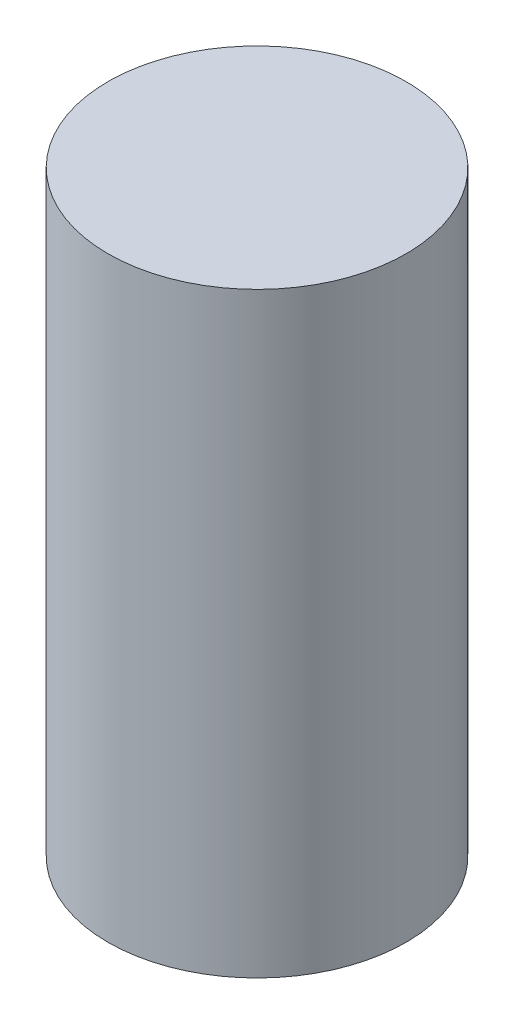
from build123d import *

# Parameters (mm, degrees)
CROQUIS1_R              = 25
SALIENTE_EXTRUIR1_DEPTH = 100


with BuildPart() as part:
    # Croquis1 → Saliente-Extruir1 (new body)
    with BuildSketch(Plane(origin=(0, 0, 0), x_dir=(1, 0, 0), z_dir=(0, 1, 0))):
        with Locations(Location((0, 0, 0), (0, 0, 270))):
            Circle(CROQUIS1_R)
    extrude(amount=SALIENTE_EXTRUIR1_DEPTH)


solid = part.part
